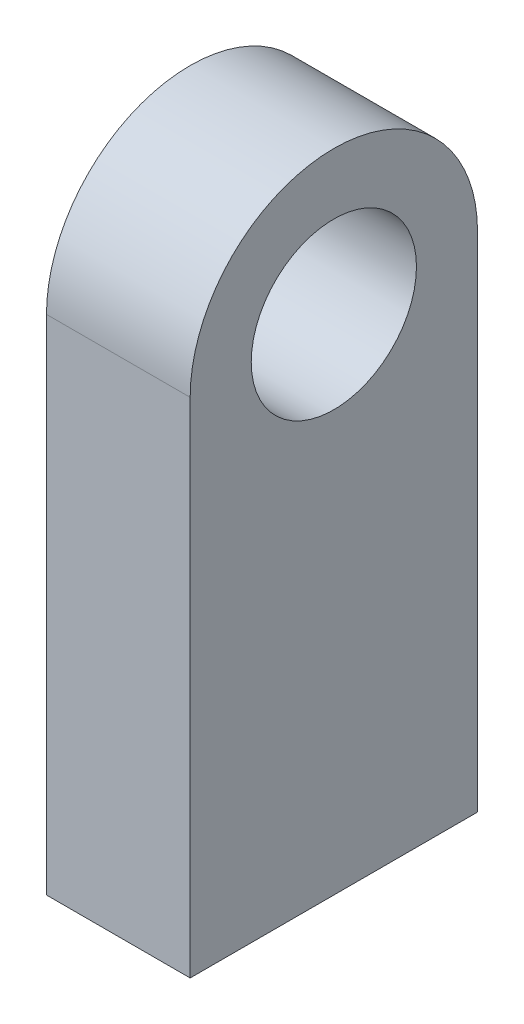
from build123d import *

# Parameters (mm, degrees)
SKETCH1_R           = 11.5
BOSS_EXTRUDE1_DEPTH = 20


with BuildPart() as part:
    # Sketch1 → Boss-Extrude1 (new body)
    with BuildSketch(Plane(origin=(0, 0, 0), x_dir=(0, 0, -1), z_dir=(1, 0, 0))):
        with BuildLine():
            Line((-20, 35), (-20, -35))
            Line((-20, -35), (20, -35))
            Line((20, -35), (20, 35))
            ThreePointArc((20, 35), (0, 55), (-20, 35))
        make_face()
        with Locations((0, 35)):
            Circle(SKETCH1_R, mode=Mode.SUBTRACT)
    extrude(amount=BOSS_EXTRUDE1_DEPTH)


solid = part.part
